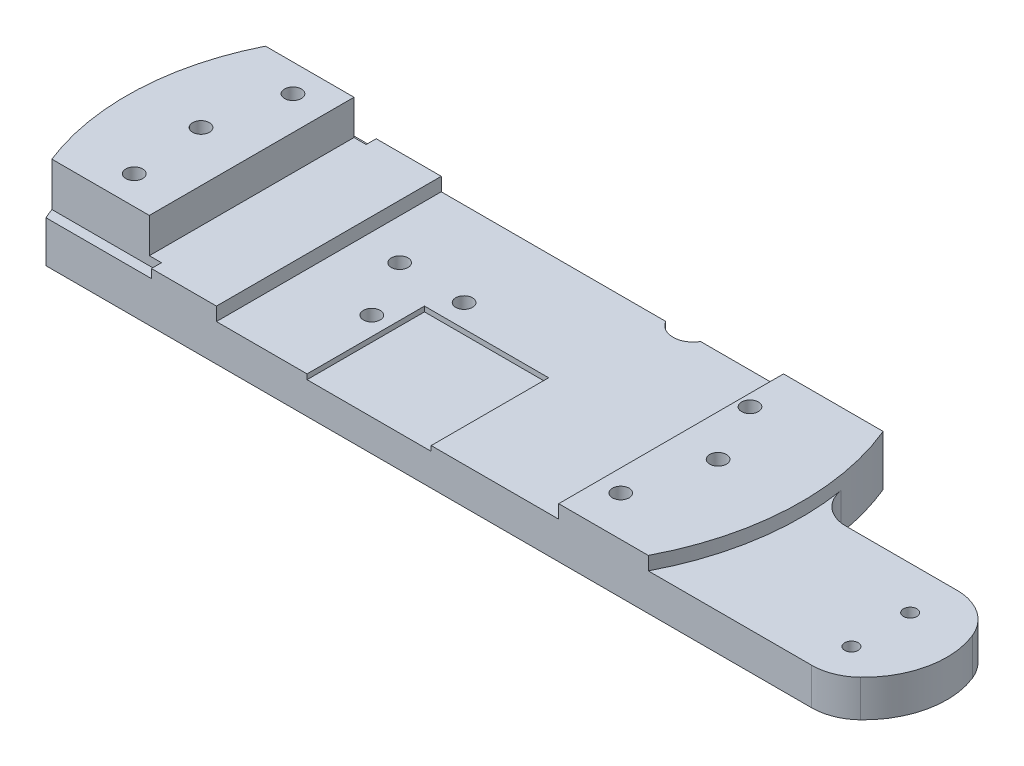
from build123d import *

# Parameters (mm, degrees)
SKETCH1_W           = 195
SKETCH1_H           = 67
BOSS_EXTRUDE1_DEPTH = 25.4
CUT_EXTRUDE1_DEPTH  = 107.177492907
CUT_EXTRUDE2_DEPTH  = 121.997561959
CUT_EXTRUDE3_START  = -13
SKETCH4_W           = 3.612655346
SKETCH4_H           = 3
CUT_EXTRUDE3_DEPTH  = 13
SKETCH6_R           = 2.5
CUT_EXTRUDE4_DEPTH  = 107.177492907
SKETCH7_W           = 37
SKETCH7_H           = 35
CUT_EXTRUDE5_DEPTH  = 1.5
CUT_EXTRUDE6_DEPTH  = 18.5
SKETCH9_R           = 2
BOSS_EXTRUDE2_DEPTH = 11
FILLET1_R           = 10


with BuildPart() as part:
    # Sketch1 → Boss-Extrude1 (new body)
    with BuildSketch(Plane(origin=(0, 0, 0), x_dir=(1, 0, 0), z_dir=(0, 1, 0))):
        Rectangle(SKETCH1_W, SKETCH1_H)
    extrude(amount=BOSS_EXTRUDE1_DEPTH)

    # Sketch2 → Cut-Extrude1 (cut, through all)
    with BuildSketch(Plane.XZ):
        with BuildLine():
            Line((97.5, -3.219751644), (97.5, 33.5))
            Line((97.5, 33.5), (88.5, 33.5))
            ThreePointArc((88.5, 33.5), (95.217186872, 15.683556008), (97.5, -3.219751644))
        make_face()
        with BuildLine():
            Line((97.5, -33.5), (97.5, -3.219751644))
            ThreePointArc((97.5, -3.219751644), (95.985558513, -18.65423771), (91.5, -33.5))
            Line((91.5, -33.5), (97.5, -33.5))
        make_face()
        with BuildLine():
            ThreePointArc((-88, -33.5), (-95.08607052, -15.861694529), (-97.5, 2.992884749))
            Line((-97.5, 2.992884749), (-97.5, -33.5))
            Line((-97.5, -33.5), (-88, -33.5))
        make_face()
        with BuildLine():
            ThreePointArc((-97.5, 2.992884749), (-95.856964648, 18.588830376), (-91, 33.5))
            Line((-91, 33.5), (-97.5, 33.5))
            Line((-97.5, 33.5), (-97.5, 2.992884749))
        make_face()
    extrude(amount=-CUT_EXTRUDE1_DEPTH, mode=Mode.SUBTRACT)

    # Sketch3 → Cut-Extrude2 (cut, through all)
    with BuildSketch(Plane(origin=(0, 0, 33.5), x_dir=(-1, 0, 0), z_dir=(0, 0, -1))):
        Polygon((63.2, 25.4), (63.2, 15), (40.2, 15), (40.2, 11), (-61.8, 11), (-61.8, 15), (-97.5, 15), (-97.5, 25.4), align=None)
    extrude(amount=CUT_EXTRUDE2_DEPTH, mode=Mode.SUBTRACT)

    # Sketch4 → Cut-Extrude3 (cut)
    with BuildSketch(Plane(origin=(0, 25.4, 0), x_dir=(1, 0, 0), z_dir=(0, 1, 0)).offset(CUT_EXTRUDE3_START)):
        with BuildLine():
            Line((-63.2, 30.5), (-63.2, 33.5))
            Line((-63.2, 33.5), (-88, 33.5))
            ThreePointArc((-88, 33.5), (-88.810680862, 32.008999469), (-89.587344654, 30.5))
            Line((-89.587344654, 30.5), (-63.2, 30.5))
        make_face()
        with Locations((-61.393672327, 32)):
            Rectangle(SKETCH4_W, SKETCH4_H)
        with BuildLine():
            Line((-63.2, -33.5), (-63.2, -30.5))
            Line((-63.2, -30.5), (-92.261692194, -30.5))
            ThreePointArc((-92.261692194, -30.5), (-91.647155152, -32.006859002), (-91, -33.5))
            Line((-91, -33.5), (-63.2, -33.5))
        make_face()
        with Locations((-61.393672327, -32)):
            Rectangle(SKETCH4_W, SKETCH4_H)
    extrude(amount=CUT_EXTRUDE3_DEPTH, mode=Mode.SUBTRACT)

    # Sketch6 → Cut-Extrude4 (cut, through all)
    with BuildSketch(Plane.XZ):
        with Locations(Location((-28.1, -9, 0), (0, 0, 270))):
            Circle(SKETCH6_R)
        with Locations(Location((-8.2, -8.3, 0), (0, 0, 270))):
            Circle(SKETCH6_R)
        with Locations(Location((-18.7, 8.7, 0), (0, 0, 270))):
            Circle(SKETCH6_R)
        with Locations(Location((-76.2, 22, 0), (0, 0, 270))):
            Circle(SKETCH6_R)
        with Locations(Location((-78.2, 0.1, 0), (0, 0, 270))):
            Circle(SKETCH6_R)
        with Locations(Location((-73.2, -22.3, 0), (0, 0, 270))):
            Circle(SKETCH6_R)
        with Locations(Location((65.3, -20, 0), (0, 0, 270))):
            Circle(SKETCH6_R)
        with Locations(Location((74.1, -1.7, 0), (0, 0, 270))):
            Circle(SKETCH6_R)
        with Locations(Location((68.3, 21.5, 0), (0, 0, 270))):
            Circle(SKETCH6_R)
    extrude(amount=-CUT_EXTRUDE4_DEPTH, mode=Mode.SUBTRACT)

    # Sketch7 → Cut-Extrude5 (cut)
    with BuildSketch(Plane(origin=(0, 11, 0), x_dir=(1, 0, 0), z_dir=(0, 1, 0))):
        with Locations((5.3, -16)):
            Rectangle(SKETCH7_W, SKETCH7_H)
    extrude(amount=-CUT_EXTRUDE5_DEPTH, mode=Mode.SUBTRACT)

    # Sketch8 → Cut-Extrude6 (cut)
    with BuildSketch(Plane(origin=(0, 25.4, 0), x_dir=(1, 0, 0), z_dir=(0, 1, 0))):
        with BuildLine():
            Line((37.096152423, 33.5), (31.9, 33.5))
            Line((31.9, 33.5), (31.9, 30.5))
            ThreePointArc((31.9, 30.5), (34.9, 31.303847577), (37.096152423, 33.5))
        make_face()
        with BuildLine():
            Line((31.9, 33.5), (26.703847577, 33.5))
            ThreePointArc((26.703847577, 33.5), (28.9, 31.303847577), (31.9, 30.5))
            Line((31.9, 30.5), (31.9, 33.5))
        make_face()
    extrude(amount=-CUT_EXTRUDE6_DEPTH, mode=Mode.SUBTRACT)

    # Sketch9 → Boss-Extrude2 (add)
    with BuildSketch(Plane.XZ):
        with BuildLine():
            Line((88.5, 33.5), (137.200361796, 33.5))
            ThreePointArc((137.200361796, 33.5), (142.769729546, 32.427747228), (147.542861296, 29.364285714))
            ThreePointArc((147.542861296, 29.364285714), (154.743476693, 16.527679502), (153.473750823, 1.864285714))
            ThreePointArc((153.473750823, 1.864285714), (147.953179578, -4.940573023), (139.572717606, -7.5))
            Line((139.572717606, -7.5), (97.384558849, -7.5))
            ThreePointArc((97.384558849, -7.5), (95.698800641, 13.597328658), (88.5, 33.5))
        make_face()
        with Locations(Location((138.3, 5.25, 0), (0, 0, 270))):
            Circle(SKETCH9_R, mode=Mode.SUBTRACT)
        with Locations(Location((138.3, 22.75, 0), (0, 0, 270))):
            Circle(SKETCH9_R, mode=Mode.SUBTRACT)
    extrude(amount=-BOSS_EXTRUDE2_DEPTH)

    # Fillet1
    fillet1_edges = [part.edges().sort_by_distance(p)[0] for p in [
        (97.384558849, 5.5, -7.5),
    ]]
    fillet(fillet1_edges, radius=FILLET1_R)


solid = part.part
